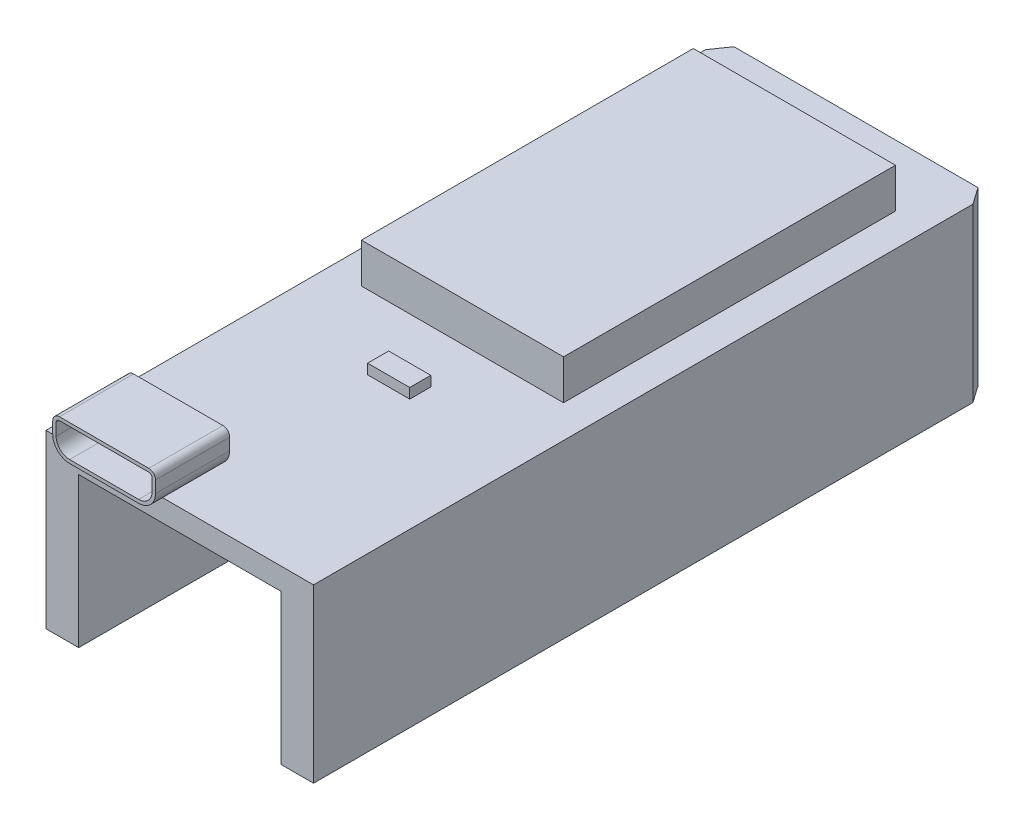
from build123d import *

# Parameters (mm, degrees)
BOSS_EXTRUDE1_DEPTH      = 50.9778
CHAMFER1_SIZE            = 0.889
CHAMFER1_SIZE2           = 1.269623578
BOSS_EXTRUDE2_DEPTH      = 1.27
BOSS_EXTRUDE2_DEPTH_BACK = 4.318
CUT_EXTRUDE1_DEPTH       = 5.08
SKETCH4_W                = 3.175
SKETCH4_H                = 1.5875
BOSS_EXTRUDE3_DEPTH      = 0.762
SKETCH5_W                = 15.24
SKETCH5_H                = 25.019
BOSS_EXTRUDE4_DEPTH      = 2.9972


with BuildPart() as part:
    # Sketch1 → Boss-Extrude1 (new body)
    with BuildSketch(Plane.XY):
        Polygon((0, 0), (2.4638, 0), (2.4638, 11.303), (17.7038, 11.303), (17.7038, 0), (20.1676, 0), (20.1676, 12.954), (0, 12.954), align=None)
    extrude(amount=BOSS_EXTRUDE1_DEPTH)

    # Chamfer1
    chamfer1_edges = [part.edges().sort_by_distance(p)[0] for p in [
        (0, 6.477, 0),
        (20.1676, 6.477, 0),
    ]]
    chamfer1_side = [part.faces().sort_by_distance(p)[0] for p in [
        (1.2319, 0.239695266, 0),
    ]]
    chamfer(chamfer1_edges, length=CHAMFER1_SIZE, length2=CHAMFER1_SIZE2, reference=chamfer1_side[0])

    # Sketch2 → Boss-Extrude2 (add, two sides: drawn at the far end of the back side and taken through both)
    with BuildSketch(Plane.XY.offset(50.9778).offset(-BOSS_EXTRUDE2_DEPTH_BACK)):
        with BuildLine():
            Line((3.048, 12.954), (8.255, 12.954))
            ThreePointArc((8.255, 12.954), (9.153025612, 13.325974388), (9.525, 14.224))
            Line((9.525, 14.224), (9.525, 15.113))
            ThreePointArc((9.525, 15.113), (9.376210245, 15.472210245), (9.017, 15.621))
            Line((9.017, 15.621), (2.286, 15.621))
            ThreePointArc((2.286, 15.621), (1.926789755, 15.472210245), (1.778, 15.113))
            Line((1.778, 15.113), (1.778, 14.224))
            ThreePointArc((1.778, 14.224), (2.149974388, 13.325974388), (3.048, 12.954))
        make_face()
    extrude(amount=BOSS_EXTRUDE2_DEPTH + BOSS_EXTRUDE2_DEPTH_BACK)

    # Sketch3 → Cut-Extrude1 (cut)
    with BuildSketch(Plane.XY.offset(52.2478)):
        with BuildLine():
            Line((9.271, 14.224), (9.271, 15.113))
            ThreePointArc((9.271, 15.113), (9.196605122, 15.292605122), (9.017, 15.367))
            Line((9.017, 15.367), (2.286, 15.367))
            ThreePointArc((2.286, 15.367), (2.106394878, 15.292605122), (2.032, 15.113))
            Line((2.032, 15.113), (2.032, 14.224))
            ThreePointArc((2.032, 14.224), (2.32957951, 13.50557951), (3.048, 13.208))
            Line((3.048, 13.208), (8.255, 13.208))
            ThreePointArc((8.255, 13.208), (8.97342049, 13.50557951), (9.271, 14.224))
        make_face()
    extrude(amount=-CUT_EXTRUDE1_DEPTH, mode=Mode.SUBTRACT)

    # Sketch4 → Boss-Extrude3 (add)
    with BuildSketch(Plane(origin=(0, 12.954, 0), x_dir=(1, 0, 0), z_dir=(0, 1, 0))):
        with Locations((10.0838, -34.43605)):
            Rectangle(SKETCH4_W, SKETCH4_H)
    extrude(amount=BOSS_EXTRUDE3_DEPTH)

    # Sketch5 → Boss-Extrude4 (add)
    with BuildSketch(Plane(origin=(0, 12.954, 0), x_dir=(1, 0, 0), z_dir=(0, 1, 0))):
        with Locations((10.0838, -17.1577)):
            Rectangle(SKETCH5_W, SKETCH5_H)
    extrude(amount=BOSS_EXTRUDE4_DEPTH)


solid = part.part
